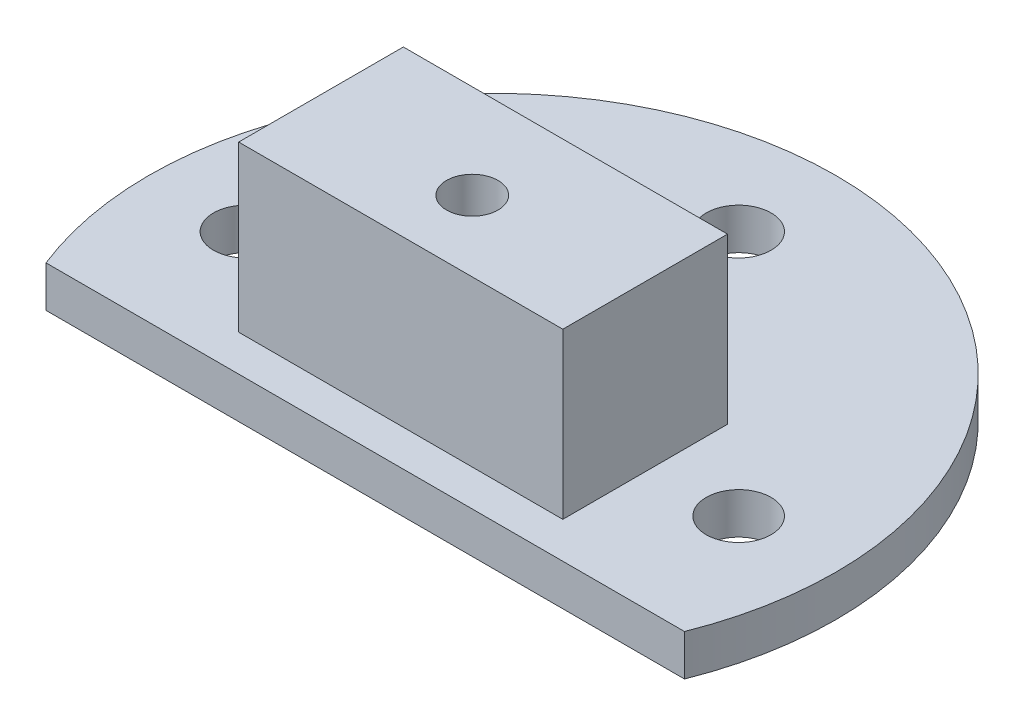
from build123d import *

# Parameters (mm, degrees)
SKETCH1_R           = 5
BOSS_EXTRUDE4_DEPTH = 6.35
SKETCH5_W           = 50
SKETCH5_H           = 25.4
BOSS_EXTRUDE5_DEPTH = 25.4
CUT_EXTRUDE1_START  = -31.75
SKETCH6_R           = 3.96875
CUT_EXTRUDE1_DEPTH  = 31.75


with BuildPart() as part:
    # Sketch1 → Boss-Extrude4 (new body)
    with BuildSketch(Plane(origin=(0, 0, 0), x_dir=(1, 0, 0), z_dir=(0, 1, 0))):
        with BuildLine():
            Line((-49.242854308, -19.599522943), (49.242854308, -19.599522943))
            ThreePointArc((49.242854308, -19.599522943), (0, 53), (-49.242854308, -19.599522943))
        make_face()
        with Locations(Location((-38, 0, 0), (0, 0, 270))):
            Circle(SKETCH1_R, mode=Mode.SUBTRACT)
        with Locations(Location((38, 0, 0), (0, 0, 270))):
            Circle(SKETCH1_R, mode=Mode.SUBTRACT)
        with Locations(Location((0, 38, 0), (0, 0, 270))):
            Circle(SKETCH1_R, mode=Mode.SUBTRACT)
    extrude(amount=BOSS_EXTRUDE4_DEPTH)

    # Sketch5 → Boss-Extrude5 (add)
    with BuildSketch(Plane(origin=(0, 6.35, 0), x_dir=(1, 0, 0), z_dir=(0, 1, 0))):
        with Locations((-0.122917413, -1.3)):
            Rectangle(SKETCH5_W, SKETCH5_H)
    extrude(amount=BOSS_EXTRUDE5_DEPTH)

    # Sketch6 → Cut-Extrude1 (cut)
    with BuildSketch(Plane(origin=(0, 31.75, 0), x_dir=(1, 0, 0), z_dir=(0, 1, 0)).offset(CUT_EXTRUDE1_START)):
        with Locations(Location((0, -3.089464921, 0), (0, 0, 270))):
            Circle(SKETCH6_R)
    extrude(amount=CUT_EXTRUDE1_DEPTH, mode=Mode.SUBTRACT)


solid = part.part
